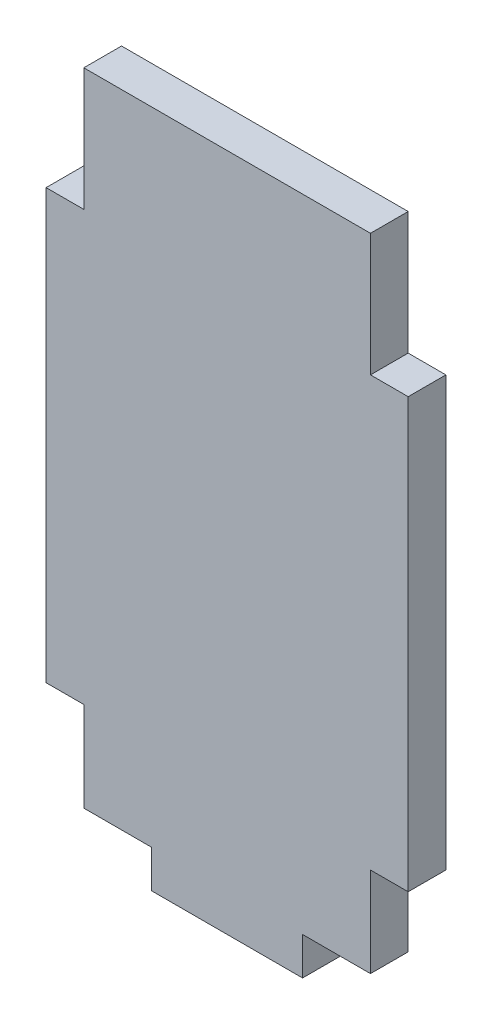
from build123d import *

# Parameters (mm, degrees)
SKIZZE1_W                       = 38
SKIZZE1_H                       = 85
SKIZZE1_W_2                     = 5
SKIZZE1_H_2                     = 56.842105263
SKIZZE1_W_3                     = 20
SKIZZE1_H_3                     = 5
AUFSATZ_LINEAR_AUSTRAGEN1_DEPTH = 5


with BuildPart() as part:
    # Skizze1 → Aufsatz-Linear austragen1 (new body)
    with BuildSketch(Plane.XY):
        with Locations((-19, -28.856779661)):
            Rectangle(SKIZZE1_W, SKIZZE1_H)
        with Locations((2.5, -31.03572703)):
            Rectangle(SKIZZE1_W_2, SKIZZE1_H_2)
        with Locations((-19, -73.856779661)):
            Rectangle(SKIZZE1_W_3, SKIZZE1_H_3)
        with Locations((-40.5, -31.03572703)):
            Rectangle(SKIZZE1_W_2, SKIZZE1_H_2)
    extrude(amount=AUFSATZ_LINEAR_AUSTRAGEN1_DEPTH)


solid = part.part
